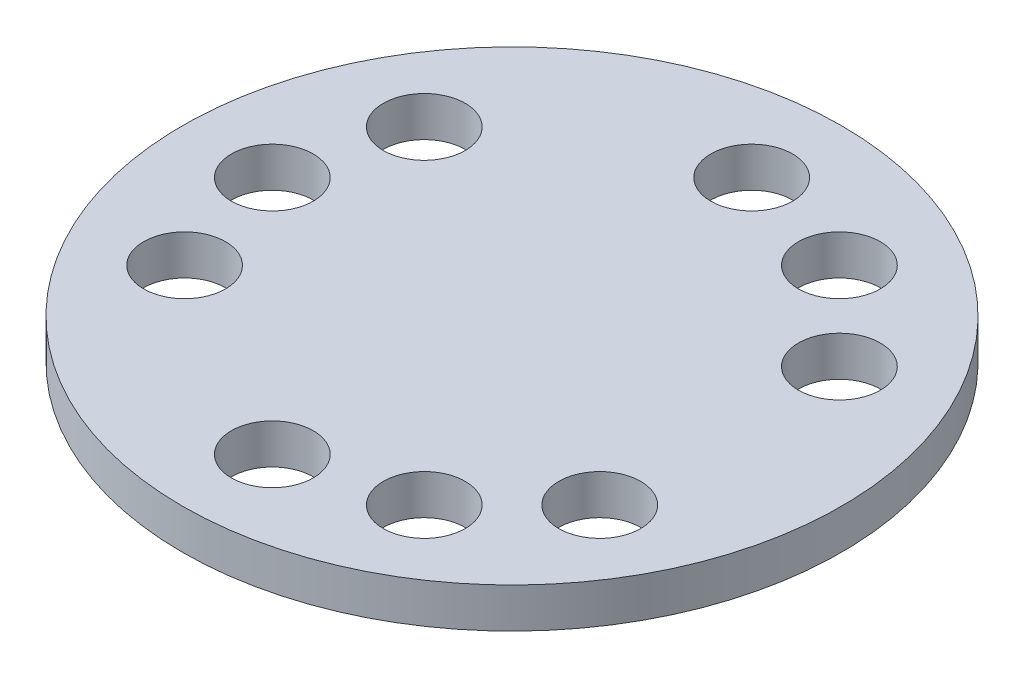
from build123d import *

# Parameters (mm, degrees)
SKETCH_1_R      = 16.5
SKETCH_1_R_2    = 2.05
EXTRUDE_1_DEPTH = 2


with BuildPart() as part:
    # 草图1 → 凸台-拉伸1 (new body)
    with BuildSketch(Plane(origin=(0, 0, 0), x_dir=(1, 0, 0), z_dir=(0, 1, 0))):
        with Locations(Location((0, 0, 0), (0, 0, 270))):
            Circle(SKETCH_1_R)
        with Locations(Location((-12, 0, 0), (0, 0, 270))):
            Circle(SKETCH_1_R_2, mode=Mode.SUBTRACT)
        with Locations(Location((6, 10.392304845, 0), (0, 0, 270))):
            Circle(SKETCH_1_R_2, mode=Mode.SUBTRACT)
        with Locations(Location((6, -10.392304845, 0), (0, 0, 270))):
            Circle(SKETCH_1_R_2, mode=Mode.SUBTRACT)
        with Locations(Location((0, 12, 0), (0, 0, 270))):
            Circle(SKETCH_1_R_2, mode=Mode.SUBTRACT)
        with Locations(Location((-10.392304845, 6, 0), (0, 0, 270))):
            Circle(SKETCH_1_R_2, mode=Mode.SUBTRACT)
        with Locations(Location((10.392304845, 6, 0), (0, 0, 270))):
            Circle(SKETCH_1_R_2, mode=Mode.SUBTRACT)
        with Locations(Location((10.392304845, -6, 0), (0, 0, 270))):
            Circle(SKETCH_1_R_2, mode=Mode.SUBTRACT)
        with Locations(Location((0, -12, 0), (0, 0, 270))):
            Circle(SKETCH_1_R_2, mode=Mode.SUBTRACT)
        with Locations(Location((-10.392304845, -6, 0), (0, 0, 270))):
            Circle(SKETCH_1_R_2, mode=Mode.SUBTRACT)
    extrude(amount=EXTRUDE_1_DEPTH)


solid = part.part
